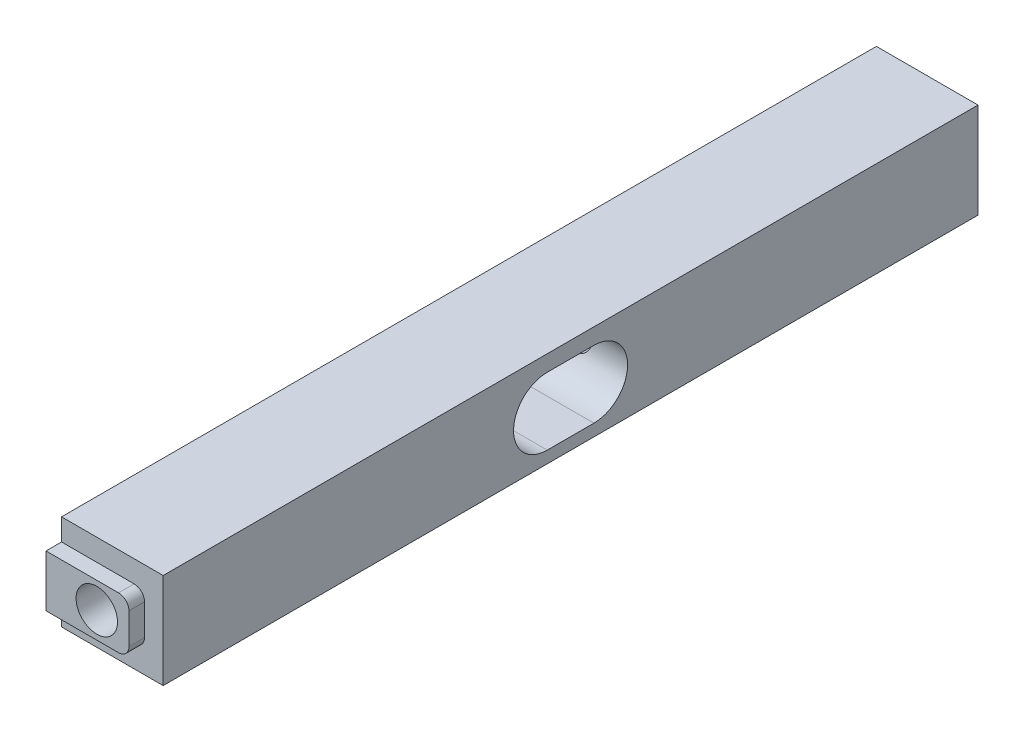
from build123d import *

# Parameters (mm, degrees)
SKETCH1_W               = 81.6
SKETCH1_H               = 0.9
SKETCH1_H_2             = 7.4
BOSS_EXTRUDE1_DEPTH     = 9.8
SKETCH5_W               = 9.8
SKETCH5_H               = 9.2
CUT_EXTRUDE3_DEPTH      = 1.5
CUT_EXTRUDE1_REACH      = 84.315
CUT_EXTRUDE1_END_RADIUS = 3.25
SKETCH3_R               = 1.45
CUT_EXTRUDE2_REACH      = 84.315
CUT_EXTRUDE2_END_RADIUS = 11.25
SKETCH4_R               = 2


with BuildPart() as part:
    # Sketch1 → Boss-Extrude1 (new body)
    # profile 1 of 3: a face of its own
    with BuildSketch(Plane(origin=(0, 0, 0), x_dir=(0, 0, -1), z_dir=(1, 0, 0))):
        with Locations((0, 4.15)):
            Rectangle(SKETCH1_W, SKETCH1_H)
    # profile 2 of 3: a face of its own
    with BuildSketch(Plane(origin=(0, 0, 0), x_dir=(0, 0, -1), z_dir=(1, 0, 0))):
        Rectangle(SKETCH1_W, SKETCH1_H_2)
        with BuildLine():
            ThreePointArc((-2.25, -3.45), (-5.5, -0.2), (-2.25, 3.05))
            Line((-2.25, 3.05), (2.25, 3.05))
            ThreePointArc((2.25, 3.05), (5.5, -0.2), (2.25, -3.45))
            Line((2.25, -3.45), (-2.25, -3.45))
        make_face(mode=Mode.SUBTRACT)
    # profile 3 of 3: a face of its own
    with BuildSketch(Plane(origin=(0, 0, 0), x_dir=(0, 0, -1), z_dir=(1, 0, 0))):
        with Locations((0, -4.15)):
            Rectangle(SKETCH1_W, SKETCH1_H)
    extrude(amount=BOSS_EXTRUDE1_DEPTH)

    # Sketch5 → Cut-Extrude3 (cut)
    with BuildSketch(Plane.XY.offset(40.8)):
        with Locations((4.9, 0)):
            Rectangle(SKETCH5_W, SKETCH5_H)
        with BuildLine():
            Line((7, 2.5), (0, 2.5))
            Line((0, 2.5), (0, -2.5))
            Line((0, -2.5), (7, -2.5))
            ThreePointArc((7, -2.5), (7.707106781, -2.207106781), (8, -1.5))
            Line((8, -1.5), (8, 1.5))
            ThreePointArc((8, 1.5), (7.707106781, 2.207106781), (7, 2.5))
        make_face(mode=Mode.SUBTRACT)
    cut_extrude3 = extrude(amount=-CUT_EXTRUDE3_DEPTH, mode=Mode.SUBTRACT)

    # Cut-Extrude1: up to this cylinder (the profile starts outside it)
    cut_extrude1_end = Plane(origin=(4.9, -0.2, 2.25), z_dir=(-1, 0, 0)) * Cylinder(CUT_EXTRUDE1_END_RADIUS, 176.13, mode=Mode.PRIVATE)
    # Sketch3 → Cut-Extrude1 (cut, up to the surface)
    with BuildSketch(Plane.XY.offset(40.8), mode=Mode.PRIVATE) as cut_extrude1_sk1:
        with Locations((4.9, 0)):
            Circle(SKETCH3_R)
    cut_extrude1_tool1 = extrude(cut_extrude1_sk1.sketch, amount=-CUT_EXTRUDE1_REACH, mode=Mode.PRIVATE) - cut_extrude1_end
    cut_extrude1 = cut_extrude1_tool1.solids().sort_by_distance((4.9, 0, 40.8))[0]
    add(cut_extrude1, mode=Mode.SUBTRACT)

    # Cut-Extrude2: up to this cylinder (the profile starts outside it)
    cut_extrude2_end = Plane(origin=(4.9, -0.2, 2.25), z_dir=(-1, 0, 0)) * Cylinder(CUT_EXTRUDE2_END_RADIUS, 192.13, mode=Mode.PRIVATE)
    # Sketch4 → Cut-Extrude2 (cut, up to the surface)
    with BuildSketch(Plane.XY.offset(40.8), mode=Mode.PRIVATE) as cut_extrude2_sk1:
        with Locations((4.9, 0)):
            Circle(SKETCH4_R)
    cut_extrude2_tool1 = extrude(cut_extrude2_sk1.sketch, amount=-CUT_EXTRUDE2_REACH, mode=Mode.PRIVATE) - cut_extrude2_end
    cut_extrude2 = cut_extrude2_tool1.solids().sort_by_distance((4.9, 0, 40.8))[0]
    add(cut_extrude2, mode=Mode.SUBTRACT)

    # Mirror5: Cut-Extrude3, Cut-Extrude1, Cut-Extrude2 across plane
    add(cut_extrude3.mirror(Plane.XY), mode=Mode.SUBTRACT)
    add(cut_extrude1.mirror(Plane.XY), mode=Mode.SUBTRACT)
    add(cut_extrude2.mirror(Plane.XY), mode=Mode.SUBTRACT)


solid = part.part
